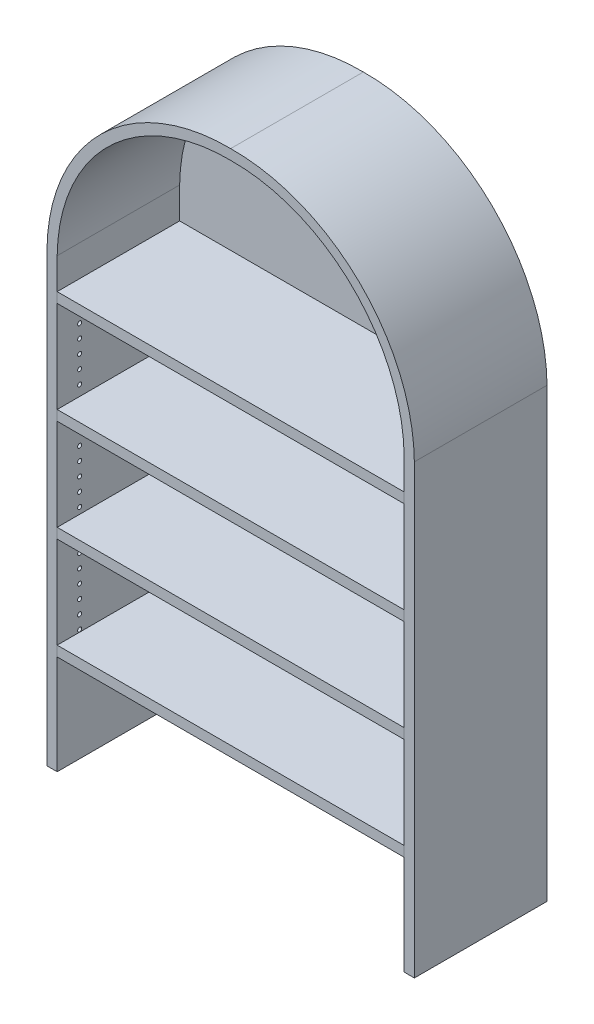
from build123d import *

# Parameters (mm, degrees)
BOSS_EXTRUDE1_DEPTH     = 25.4
BOSS_EXTRUDE2_DEPTH     = 304.8
SKETCH3_W               = 863.6
SKETCH3_H               = 25.4
BOSS_EXTRUDE3_DEPTH     = 304.8
BOSS_EXTRUDE3_2_DEPTH   = 304.8
BOSS_EXTRUDE3_3_DEPTH   = 304.8
BOSS_EXTRUDE3_4_DEPTH   = 304.8
CUT_EXTRUDE1_DEPTH      = 873.76
CUT_EXTRUDE1_DEPTH_BACK = 7.62
SKETCH4_R               = 5.08
SKETCH5_W               = 863.6
SKETCH5_H               = 46.404394364
BOSS_EXTRUDE4_DEPTH     = 25.4


with BuildPart() as part:
    # Sketch1 → Boss-Extrude1 (new body)
    with BuildSketch(Plane.XY):
        with BuildLine():
            Line((-457.2, 610.989214217), (-457.2, -501.517140678))
            Line((-457.2, -501.517140678), (457.2, -501.517140678))
            Line((457.2, -501.517140678), (457.2, 610.989214217))
            ThreePointArc((457.2, 610.989214217), (321.102609518, 928.999489029), (0, 1057.631323124))
            ThreePointArc((0, 1057.631323124), (-321.102609518, 928.999489029), (-457.2, 610.989214217))
        make_face()
    extrude(amount=BOSS_EXTRUDE1_DEPTH)

    # Sketch2 → Boss-Extrude2 (add)
    with BuildSketch(Plane.XY.offset(25.4)):
        with BuildLine():
            Line((431.8, -501.517140678), (457.2, -501.517140678))
            Line((457.2, -501.517140678), (457.2, 610.989214217))
            ThreePointArc((457.2, 610.989214217), (321.102609518, 928.999489029), (0, 1057.631323124))
            ThreePointArc((0, 1057.631323124), (-321.102609518, 928.999489029), (-457.2, 610.989214217))
            Line((-457.2, 610.989214217), (-457.2, -501.517140678))
            Line((-457.2, -501.517140678), (-431.8, -501.517140678))
            Line((-431.8, -501.517140678), (-431.8, -476.117140678))
            Line((-431.8, -476.117140678), (-431.8, 610.838723951))
            ThreePointArc((-431.8, 610.838723951), (-303.194659119, 910.985126057), (0, 1032.229487089))
            ThreePointArc((0, 1032.229487089), (303.194659119, 910.985126057), (431.8, 610.838723951))
            Line((431.8, 610.838723951), (431.8, -476.117140678))
            Line((431.8, -476.117140678), (431.8, -501.517140678))
        make_face()
    extrude(amount=BOSS_EXTRUDE2_DEPTH)


with BuildPart() as body_2:
    # Sketch3 → Boss-Extrude3 (new body)
    with BuildSketch(Plane.XY.offset(25.4)):
        with Locations((0, -241.3)):
            Rectangle(SKETCH3_W, SKETCH3_H)
    extrude(amount=BOSS_EXTRUDE3_DEPTH)


with BuildPart() as body_3:
    # Sketch3 → Boss-Extrude3 2 (new body)
    with BuildSketch(Plane.XY.offset(25.4)):
        with Locations((0, 12.7)):
            Rectangle(SKETCH3_W, SKETCH3_H)
    extrude(amount=BOSS_EXTRUDE3_2_DEPTH)


with BuildPart() as body_4:
    # Sketch3 → Boss-Extrude3 3 (new body)
    with BuildSketch(Plane.XY.offset(25.4)):
        with Locations((0, 266.7)):
            Rectangle(SKETCH3_W, SKETCH3_H)
    extrude(amount=BOSS_EXTRUDE3_3_DEPTH)


with BuildPart() as body_5:
    # Sketch3 → Boss-Extrude3 4 (new body)
    with BuildSketch(Plane.XY.offset(25.4)):
        with Locations((0, 520.7)):
            Rectangle(SKETCH3_W, SKETCH3_H)
    extrude(amount=BOSS_EXTRUDE3_4_DEPTH)


with BuildPart() as cut_extrude1_tool:
    # Sketch4 → Cut-Extrude1 (new, two sides: drawn at the far end of the back side and taken through both)
    with BuildSketch(Plane(origin=(-431.8, 0, 0), x_dir=(0, 0, -1), z_dir=(1, 0, 0)).offset(-CUT_EXTRUDE1_DEPTH_BACK)):
        with Locations((-274.254659869, 503.341488766)):
            Circle(SKETCH4_R)
        with Locations((-274.254659869, 470.321488766)):
            Circle(SKETCH4_R)
        with Locations((-274.254659869, 437.301488766)):
            Circle(SKETCH4_R)
        with Locations((-274.254659869, 404.281488766)):
            Circle(SKETCH4_R)
        with Locations((-274.254659869, 371.261488766)):
            Circle(SKETCH4_R)
        with Locations((-274.254659869, 338.241488766)):
            Circle(SKETCH4_R)
        with Locations((-274.254659869, 305.221488766)):
            Circle(SKETCH4_R)
        with Locations(Location((-274.254659869, 272.201488766, 0), (0, 0, 180))):
            Circle(SKETCH4_R)
        with Locations((-274.254659869, 239.181488766)):
            Circle(SKETCH4_R)
        with Locations((-274.254659869, 206.161488766)):
            Circle(SKETCH4_R)
        with Locations((-274.254659869, 173.141488766)):
            Circle(SKETCH4_R)
        with Locations((-274.254659869, 140.121488766)):
            Circle(SKETCH4_R)
        with Locations((-274.254659869, 107.101488766)):
            Circle(SKETCH4_R)
        with Locations((-274.254659869, 74.081488766)):
            Circle(SKETCH4_R)
        with Locations((-274.254659869, 41.061488766)):
            Circle(SKETCH4_R)
        with Locations(Location((-274.254659869, 8.041488766, 0), (0, 0, 180))):
            Circle(SKETCH4_R)
        with Locations((-274.254659869, -24.978511234)):
            Circle(SKETCH4_R)
        with Locations((-274.254659869, -57.998511234)):
            Circle(SKETCH4_R)
        with Locations((-274.254659869, -91.018511234)):
            Circle(SKETCH4_R)
        with Locations((-274.254659869, -124.038511234)):
            Circle(SKETCH4_R)
        with Locations((-274.254659869, -157.058511234)):
            Circle(SKETCH4_R)
        with Locations((-274.254659869, -190.078511234)):
            Circle(SKETCH4_R)
        with Locations((-274.254659869, -223.098511234)):
            Circle(SKETCH4_R)
        with Locations((-274.254659869, -256.118511234)):
            Circle(SKETCH4_R)
        with Locations(Location((-55.945340131, 404.281488766, 0), (0, 0, 180))):
            Circle(SKETCH4_R)
        with Locations(Location((-55.945340131, 437.301488766, 0), (0, 0, 180))):
            Circle(SKETCH4_R)
        with Locations(Location((-55.945340131, 470.321488766, 0), (0, 0, 180))):
            Circle(SKETCH4_R)
        with Locations(Location((-55.945340131, 503.341488766, 0), (0, 0, 180))):
            Circle(SKETCH4_R)
        with Locations(Location((-55.945340131, 272.201488766, 0), (0, 0, 180))):
            Circle(SKETCH4_R)
        with Locations(Location((-55.945340131, 305.221488766, 0), (0, 0, 180))):
            Circle(SKETCH4_R)
        with Locations(Location((-55.945340131, 338.241488766, 0), (0, 0, 180))):
            Circle(SKETCH4_R)
        with Locations(Location((-55.945340131, 371.261488766, 0), (0, 0, 180))):
            Circle(SKETCH4_R)
        with Locations(Location((-55.945340131, 239.181488766, 0), (0, 0, 180))):
            Circle(SKETCH4_R)
        with Locations(Location((-55.945340131, 206.161488766, 0), (0, 0, 180))):
            Circle(SKETCH4_R)
        with Locations(Location((-55.945340131, 173.141488766, 0), (0, 0, 180))):
            Circle(SKETCH4_R)
        with Locations(Location((-55.945340131, 140.121488766, 0), (0, 0, 180))):
            Circle(SKETCH4_R)
        with Locations(Location((-55.945340131, 107.101488766, 0), (0, 0, 180))):
            Circle(SKETCH4_R)
        with Locations(Location((-55.945340131, 74.081488766, 0), (0, 0, 180))):
            Circle(SKETCH4_R)
        with Locations(Location((-55.945340131, 41.061488766, 0), (0, 0, 180))):
            Circle(SKETCH4_R)
        with Locations(Location((-55.945340131, 8.041488766, 0), (0, 0, 180))):
            Circle(SKETCH4_R)
        with Locations(Location((-55.945340131, -24.978511234, 0), (0, 0, 180))):
            Circle(SKETCH4_R)
        with Locations(Location((-55.945340131, -57.998511234, 0), (0, 0, 180))):
            Circle(SKETCH4_R)
        with Locations(Location((-55.945340131, -124.038511234, 0), (0, 0, 180))):
            Circle(SKETCH4_R)
        with Locations(Location((-55.945340131, -91.018511234, 0), (0, 0, 180))):
            Circle(SKETCH4_R)
        with Locations(Location((-55.945340131, -157.058511234, 0), (0, 0, 180))):
            Circle(SKETCH4_R)
        with Locations(Location((-55.945340131, -190.078511234, 0), (0, 0, 180))):
            Circle(SKETCH4_R)
        with Locations(Location((-55.945340131, -223.098511234, 0), (0, 0, 180))):
            Circle(SKETCH4_R)
        with Locations(Location((-55.945340131, -256.118511234, 0), (0, 0, 180))):
            Circle(SKETCH4_R)
    extrude(amount=CUT_EXTRUDE1_DEPTH + CUT_EXTRUDE1_DEPTH_BACK)


with BuildPart() as part_1:
    add(part.part)

    # Cut-Extrude1: cut by cut_extrude1_tool
    add(cut_extrude1_tool.part, mode=Mode.SUBTRACT)

    # Sketch5 → Boss-Extrude4 (add)
    with BuildSketch(Plane.XY.offset(25.4)):
        with Locations((0, -478.314943496)):
            Rectangle(SKETCH5_W, SKETCH5_H)
    extrude(amount=BOSS_EXTRUDE4_DEPTH)


with BuildPart() as body_2_1:
    add(body_2.part)

    # Cut-Extrude1: cut by cut_extrude1_tool
    add(cut_extrude1_tool.part, mode=Mode.SUBTRACT)


with BuildPart() as body_3_1:
    add(body_3.part)

    # Cut-Extrude1: cut by cut_extrude1_tool
    add(cut_extrude1_tool.part, mode=Mode.SUBTRACT)


with BuildPart() as body_4_1:
    add(body_4.part)

    # Cut-Extrude1: cut by cut_extrude1_tool
    add(cut_extrude1_tool.part, mode=Mode.SUBTRACT)


with BuildPart() as body_5_1:
    add(body_5.part)

    # Cut-Extrude1: cut by cut_extrude1_tool
    add(cut_extrude1_tool.part, mode=Mode.SUBTRACT)


solid = Compound([part_1.part, body_2_1.part, body_3_1.part, body_4_1.part, body_5_1.part])
